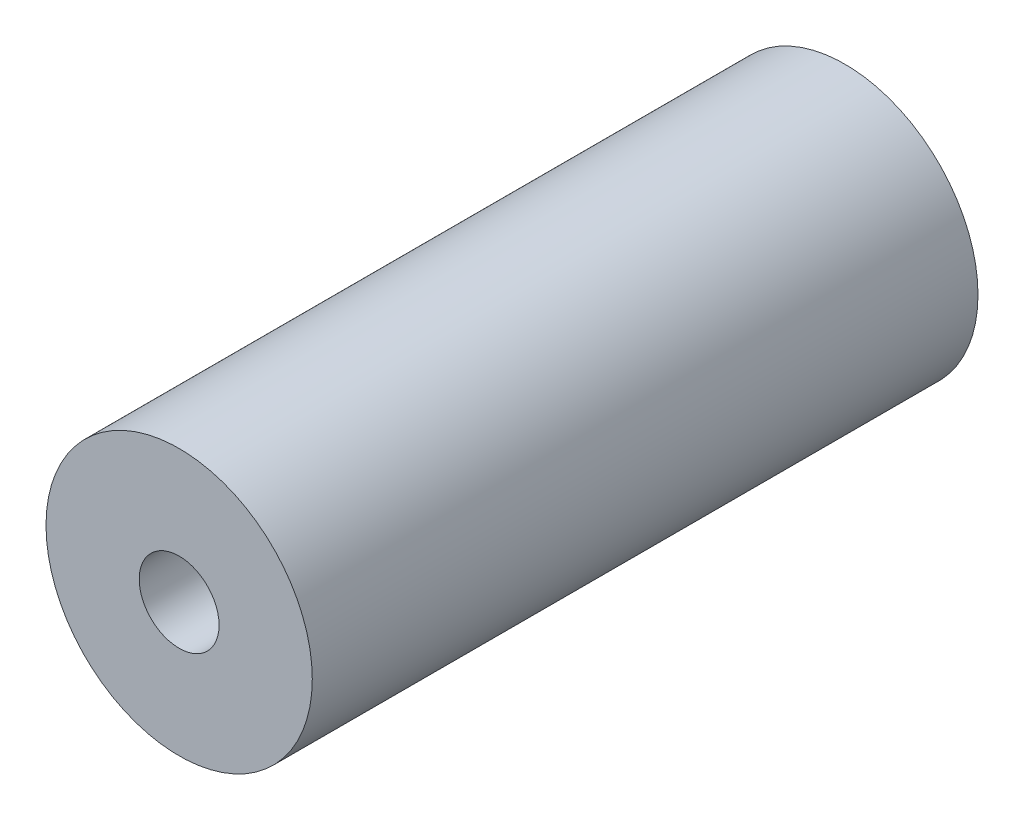
from build123d import *

# Parameters (mm, degrees)
IZIM1_R                     = 10
Y_KSEKLIK_EKSTR_ZYON1_DEPTH = 50
IZIM2_R                     = 3
KES_EKSTR_ZYON1_DEPTH       = 45


with BuildPart() as part:
    # Çizim1 → Yükseklik-Ekstrüzyon1 (new body)
    with BuildSketch(Plane.XY):
        Circle(IZIM1_R)
    extrude(amount=Y_KSEKLIK_EKSTR_ZYON1_DEPTH)

    # Çizim2 → Kes-Ekstrüzyon1 (cut)
    with BuildSketch(Plane.XY.offset(50)):
        Circle(IZIM2_R)
    extrude(amount=-KES_EKSTR_ZYON1_DEPTH, mode=Mode.SUBTRACT)


solid = part.part
